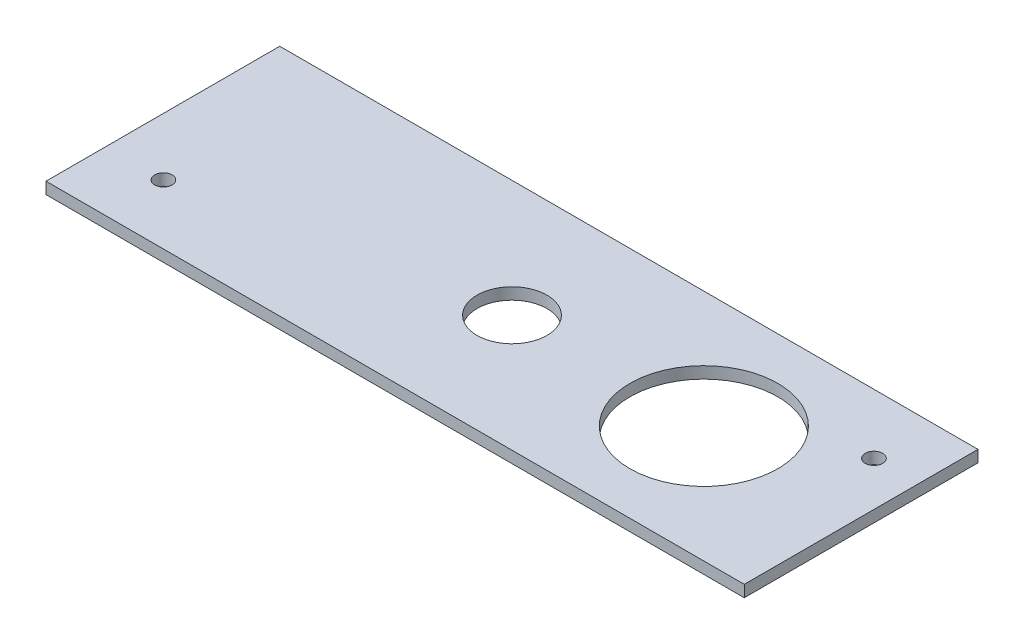
from build123d import *

# Parameters (mm, degrees)
SKETCH1_W           = 59.944
SKETCH1_H           = 20.066
SKETCH1_R           = 6.35
SKETCH1_R_2         = 0.75
SKETCH1_R_3         = 3
BOSS_EXTRUDE1_DEPTH = 1


with BuildPart() as part:
    # Sketch1 → Boss-Extrude1 (new body)
    with BuildSketch(Plane(origin=(0, 0, 0), x_dir=(1, 0, 0), z_dir=(0, 1, 0))):
        Rectangle(SKETCH1_W, SKETCH1_H)
        with Locations(Location((16.472, 0, 0), (0, 0, 270))):
            Circle(SKETCH1_R, mode=Mode.SUBTRACT)
        with Locations(Location((26.172, 4.9, 0), (0, 0, 270))):
            Circle(SKETCH1_R_2, mode=Mode.SUBTRACT)
        with Locations(Location((-25.028, -4.9, 0), (0, 0, 270))):
            Circle(SKETCH1_R_2, mode=Mode.SUBTRACT)
        with Locations(Location((0, 0, 0), (0, 0, 270))):
            Circle(SKETCH1_R_3, mode=Mode.SUBTRACT)
    extrude(amount=BOSS_EXTRUDE1_DEPTH)


solid = part.part
